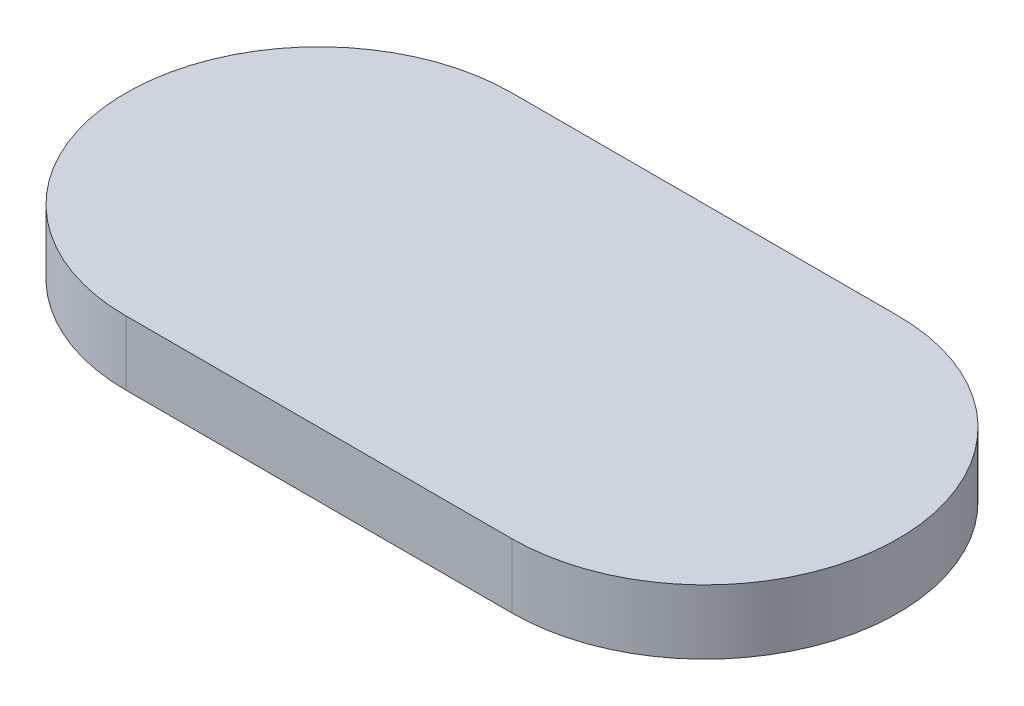
from build123d import *

# Parameters (mm, degrees)
EXTRUDE_1_DEPTH = 5
SKETCH_2_R      = 2.5
EXTRUDE_2_DEPTH = 5


with BuildPart() as part:
    # 草图1 → 凸台-拉伸1 (new body)
    with BuildSketch(Plane(origin=(0, 0, 0), x_dir=(1, 0, 0), z_dir=(0, 1, 0))):
        with BuildLine():
            Line((0, 15), (30, 15))
            ThreePointArc((30, 15), (45, 0), (30, -15))
            Line((30, -15), (0, -15))
            ThreePointArc((0, -15), (-15, 0), (0, 15))
        make_face()
    extrude(amount=EXTRUDE_1_DEPTH)

    # 草图2 → 凸台-拉伸2 (add)
    with BuildSketch(Plane.XZ):
        with Locations(Location((0, 0, 0), (0, 0, 90))):
            Circle(SKETCH_2_R)
    extrude(amount=EXTRUDE_2_DEPTH)


solid = part.part
